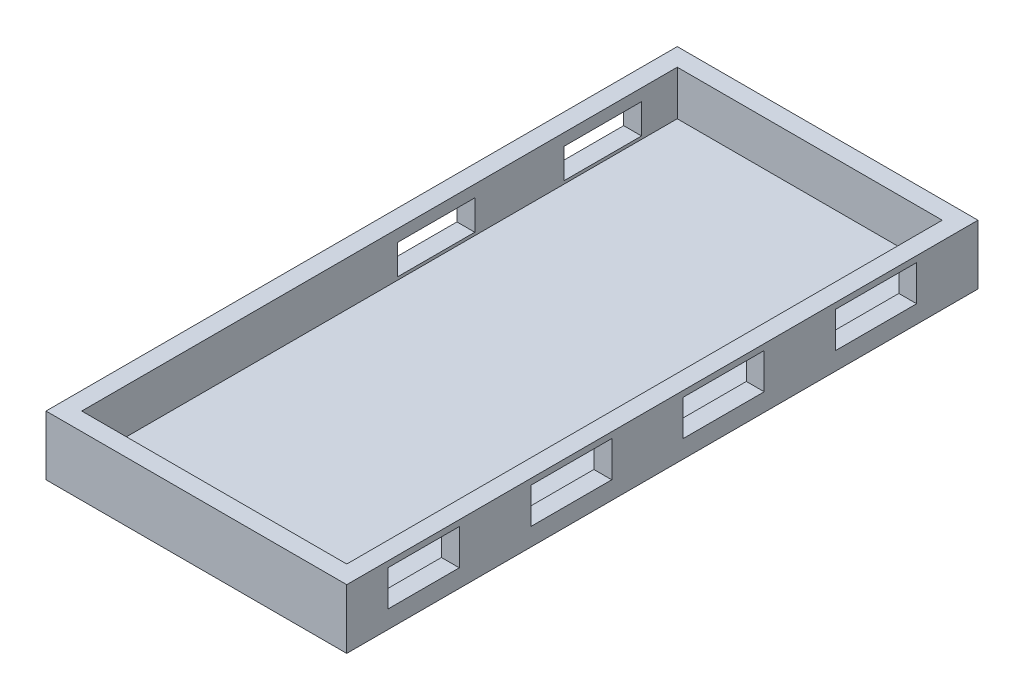
from build123d import *

# Parameters (mm, degrees)
SKETCH_1_W          = 50.5
SKETCH_1_H          = 106
EXTRUDE_1_DEPTH     = 10
SKETCH_4_W          = 44.5
SKETCH_4_H          = 100
EXTRUDE_7_DEPTH     = 7
SKETCH_4_4_W        = 44.5
SKETCH_4_4_H        = 100
CUT_EXTRUDE_1_DEPTH = 7.5
SKETCH_6_W          = 13
SKETCH_6_H          = 5
CUT_EXTRUDE_2_DEPTH = 3
SKETCH_7_W          = 13.6
SKETCH_7_H          = 6
SKETCH_7_W_2        = 12
CUT_EXTRUDE_3_DEPTH = 3


with BuildPart() as part:
    # 草图1 → 凸台-拉伸1 (new body)
    with BuildSketch(Plane(origin=(0, 0, 0), x_dir=(1, 0, 0), z_dir=(0, 1, 0))):
        with Locations((4.235483871, -32.8)):
            Rectangle(SKETCH_1_W, SKETCH_1_H)
    extrude(amount=EXTRUDE_1_DEPTH)

    # 草图4 → 凸台-拉伸7 (add)
    with BuildSketch(Plane(origin=(0, 10, 0), x_dir=(1, 0, 0), z_dir=(0, 1, 0))):
        with Locations((4.235483871, -32.8)):
            Rectangle(SKETCH_4_W, SKETCH_4_H)
    extrude(amount=-EXTRUDE_7_DEPTH)

    # 草图4<4> → 切除-拉伸1 (cut)
    with BuildSketch(Plane(origin=(0, 10, 0), x_dir=(1, 0, 0), z_dir=(0, 1, 0))):
        with Locations((4.235483871, -32.8)):
            Rectangle(SKETCH_4_4_W, SKETCH_4_4_H)
    extrude(amount=-CUT_EXTRUDE_1_DEPTH, mode=Mode.SUBTRACT)

    # 草图6 → 切除-拉伸2 (cut)
    with BuildSketch(Plane.ZY.offset(21.014516129)):
        with Locations((-4.7, 5.5)):
            Rectangle(SKETCH_6_W, SKETCH_6_H)
        with Locations((23.3, 5.5)):
            Rectangle(SKETCH_6_W, SKETCH_6_H)
    extrude(amount=-CUT_EXTRUDE_2_DEPTH, mode=Mode.SUBTRACT)

    # 草图7 → 切除-拉伸3 (cut)
    with BuildSketch(Plane(origin=(29.485483871, 0, 0), x_dir=(0, 0, -1), z_dir=(1, 0, 0))):
        with Locations((3.1, 6)):
            Rectangle(SKETCH_7_W, SKETCH_7_H)
        with Locations((-22.5, 6)):
            Rectangle(SKETCH_7_W, SKETCH_7_H)
        with Locations((-48.1, 6)):
            Rectangle(SKETCH_7_W, SKETCH_7_H)
        with Locations((-72.9, 6)):
            Rectangle(SKETCH_7_W_2, SKETCH_7_H)
    extrude(amount=-CUT_EXTRUDE_3_DEPTH, mode=Mode.SUBTRACT)


solid = part.part
